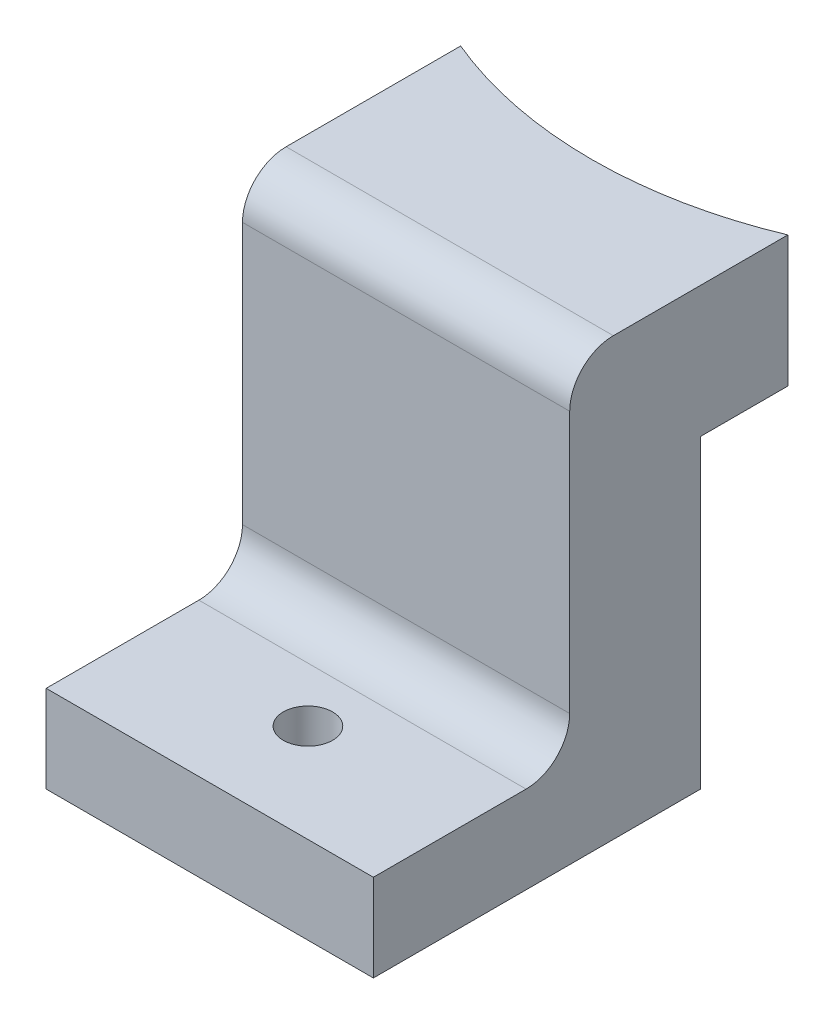
from build123d import *

# Parameters (mm, degrees)
SKETCH1_W                 = 15
SKETCH1_H                 = 10
BOSS_EXTRUDE1_DEPTH       = 6
SKETCH2_R                 = 19.5
CUT_EXTRUDE1_DEPTH        = 9
SKETCH3_W                 = 15
SKETCH3_H                 = 6
BOSS_EXTRUDE2_DEPTH       = 20
SKETCH4_W                 = 15
SKETCH4_H                 = 4
BOSS_EXTRUDE3_DEPTH       = 9
F_4_40_TAPPED_HOLE2_D     = 2.2606
F_4_40_TAPPED_HOLE2_DEPTH = 7.6
F_4_40_TAPPED_HOLE2_TIP   = 0.679152758
FILLET2_R                 = 2


with BuildPart() as part:
    # Sketch1 → Boss-Extrude1 (new body)
    with BuildSketch(Plane(origin=(0, 0, 0), x_dir=(1, 0, 0), z_dir=(0, 1, 0))):
        Rectangle(SKETCH1_W, SKETCH1_H)
    extrude(amount=BOSS_EXTRUDE1_DEPTH)

    # Sketch2 → Cut-Extrude1 (cut)
    with BuildSketch(Plane(origin=(0, 6, 0), x_dir=(1, 0, 0), z_dir=(0, 1, 0))):
        with Locations((0, 23)):
            Circle(SKETCH2_R)
    extrude(amount=-CUT_EXTRUDE1_DEPTH, mode=Mode.SUBTRACT)

    # Sketch3 → Boss-Extrude2 (add)
    with BuildSketch(Plane(origin=(0, 6, 0), x_dir=(1, 0, 0), z_dir=(0, 1, 0))):
        with Locations((0, -2)):
            Rectangle(SKETCH3_W, SKETCH3_H)
    extrude(amount=-BOSS_EXTRUDE2_DEPTH)

    # Sketch4 → Boss-Extrude3 (add)
    with BuildSketch(Plane.XY.offset(5)):
        with Locations((0, -12)):
            Rectangle(SKETCH4_W, SKETCH4_H)
    extrude(amount=BOSS_EXTRUDE3_DEPTH)

    # #4-40 Tapped Hole2
    with Locations(Plane(origin=(0, -14, 0), x_dir=(-1, 0, 0), z_dir=(0, -1, 0))):
        with Locations((0, -9.5)):
            Hole(F_4_40_TAPPED_HOLE2_D / 2, depth=F_4_40_TAPPED_HOLE2_DEPTH)
            with Locations((0, 0, -(F_4_40_TAPPED_HOLE2_DEPTH + F_4_40_TAPPED_HOLE2_TIP / 2))):  # 118° drill point
                Cone(0, F_4_40_TAPPED_HOLE2_D / 2, F_4_40_TAPPED_HOLE2_TIP, mode=Mode.SUBTRACT)

    # Fillet2
    fillet2_edges = [part.edges().sort_by_distance(p)[0] for p in [
        (0, -10, 5),
        (0, 6, 5),
    ]]
    fillet(fillet2_edges, radius=FILLET2_R)


solid = part.part
